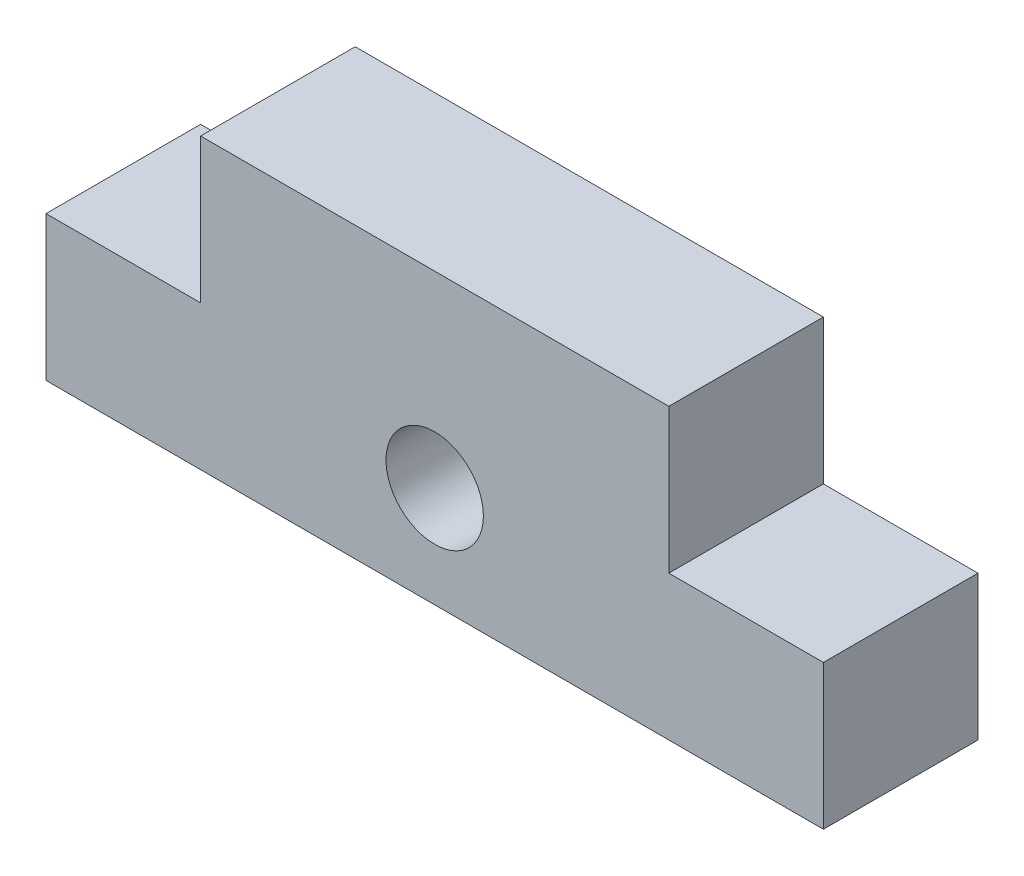
from build123d import *

# Parameters (mm, degrees)
MODEL_R             = 1.685
BOSS_EXTRUDE1_DEPTH = 5.35


with BuildPart() as part:
    # Model → Boss-Extrude1 (new body)
    with BuildSketch(Plane.XY):
        Polygon((0, 0), (26.9, 0), (26.9, 5), (21.55, 5), (21.55, 10), (5.35, 10), (5.35, 5), (0, 5), align=None)
        with Locations((13.45, 3.5)):
            Circle(MODEL_R, mode=Mode.SUBTRACT)
    extrude(amount=BOSS_EXTRUDE1_DEPTH)


solid = part.part
